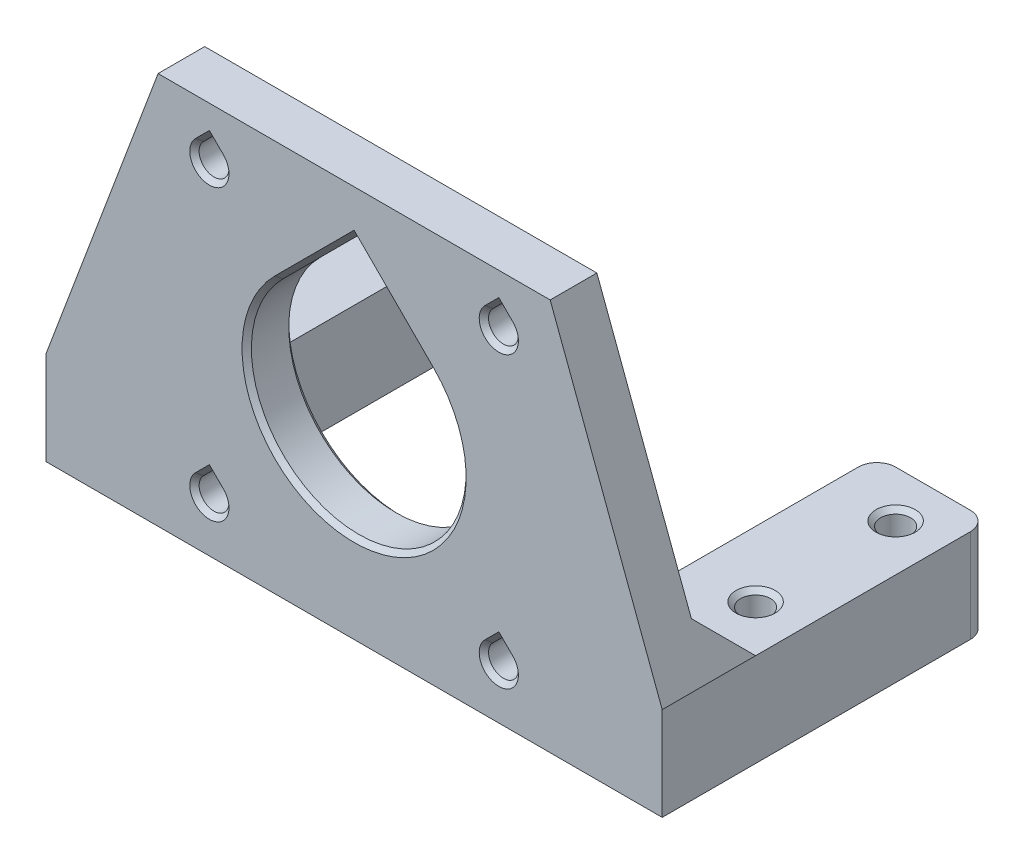
from build123d import *

# Parameters (mm, degrees)
EXTRUDE_1_DEPTH     = 5
SKETCH_2_W          = 12
SKETCH_2_H          = 10
EXTRUDE_2_DEPTH     = 30
EXTRUDE_3_DEPTH     = 5
SKETCH_5_R          = 1.6
CUT_EXTRUDE_1_DEPTH = 55.890800686
FILLET_1_R          = 2
CHAMFER_1_SIZE      = 5
CHAMFER_2_SIZE      = 0.5


with BuildPart() as part:
    # 草图1 → 凸台-拉伸1 (new body)
    with BuildSketch(Plane.XY):
        Polygon((-21, 21), (21, 21), (21, -11), (33, -11), (33, -21), (-33, -21), (-33, -11), (-21, -11), align=None)
        with BuildLine():
            Line((-15.5, 17.7627417), (-16.63137085, 16.63137085))
            ThreePointArc((-16.63137085, 16.63137085), (-15.5, 13.9), (-14.36862915, 16.63137085))
            Line((-14.36862915, 16.63137085), (-15.5, 17.7627417))
        make_face(mode=Mode.SUBTRACT)
        with BuildLine():
            Line((-15.5, -13.2372583), (-16.63137085, -14.36862915))
            ThreePointArc((-16.63137085, -14.36862915), (-15.5, -17.1), (-14.36862915, -14.36862915))
            Line((-14.36862915, -14.36862915), (-15.5, -13.2372583))
        make_face(mode=Mode.SUBTRACT)
        with BuildLine():
            Line((-8.131727984, 8.131727984), (0, 16.263455967))
            Line((0, 16.263455967), (8.131727984, 8.131727984))
            ThreePointArc((8.131727984, 8.131727984), (0, -11.5), (-8.131727984, 8.131727984))
        make_face(mode=Mode.SUBTRACT)
        with BuildLine():
            Line((15.5, -13.2372583), (14.36862915, -14.36862915))
            ThreePointArc((14.36862915, -14.36862915), (15.5, -17.1), (16.63137085, -14.36862915))
            Line((16.63137085, -14.36862915), (15.5, -13.2372583))
        make_face(mode=Mode.SUBTRACT)
        with BuildLine():
            Line((15.5, 17.7627417), (14.36862915, 16.63137085))
            ThreePointArc((14.36862915, 16.63137085), (15.5, 13.9), (16.63137085, 16.63137085))
            Line((16.63137085, 16.63137085), (15.5, 17.7627417))
        make_face(mode=Mode.SUBTRACT)
    extrude(amount=EXTRUDE_1_DEPTH)

    # 草图2 → 凸台-拉伸2 (add)
    with BuildSketch(Plane(origin=(0, 0, 0), x_dir=(-1, 0, 0), z_dir=(0, 0, -1))):
        with Locations((-27, -16)):
            Rectangle(SKETCH_2_W, SKETCH_2_H)
        with Locations((27, -16)):
            Rectangle(SKETCH_2_W, SKETCH_2_H)
    extrude(amount=EXTRUDE_2_DEPTH)

    # 草图3 → 凸台-拉伸3 (add)
    with BuildSketch(Plane.XY.offset(5)):
        Polygon((-21, 21), (-33, -11), (-21, -11), align=None)
        Polygon((21, -11), (21, 21), (33, -11), align=None)
    extrude(amount=-EXTRUDE_3_DEPTH)

    # 草图5 → 切除-拉伸1 (cut, through all)
    with BuildSketch(Plane(origin=(0, -11, 0), x_dir=(1, 0, 0), z_dir=(0, 1, 0))):
        with Locations(Location((28, 25, 0), (0, 0, 270))):
            Circle(SKETCH_5_R)
        with Locations(Location((28, 10, 0), (0, 0, 270))):
            Circle(SKETCH_5_R)
        with Locations(Location((-28, 10, 0), (0, 0, 270))):
            Circle(SKETCH_5_R)
        with Locations(Location((-28, 25, 0), (0, 0, 270))):
            Circle(SKETCH_5_R)
    extrude(amount=-CUT_EXTRUDE_1_DEPTH, mode=Mode.SUBTRACT)

    # 圆角1
    fillet_1_edges = [part.edges().sort_by_distance(p)[0] for p in [
        (33, -16, -30),
        (21, -16, -30),
        (-21, -16, -30),
        (-33, -16, -30),
    ]]
    fillet(fillet_1_edges, radius=FILLET_1_R)

    # 倒角1
    chamfer_1_edges = [part.edges().sort_by_distance(p)[0] for p in [
        (-27, -11, 0),
        (27, -11, 0),
    ]]
    chamfer(chamfer_1_edges, length=CHAMFER_1_SIZE)

    # 倒角2
    chamfer_2_edges = [part.edges().sort_by_distance(p)[0] for p in [
        (-28, -21, -26.6),
        (-28, -11, -26.6),
        (-28, -21, -11.6),
        (-28, -11, -11.6),
        (28, -21, -11.6),
        (28, -11, -11.6),
        (28, -21, -26.6),
        (28, -11, -26.6),
        (0, -11.5, 0),
        (4.065863992, 12.197591975, 0),
        (-4.065863992, 12.197591975, 0),
        (0, -11.5, 5),
        (4.065863992, 12.197591975, 5),
        (-4.065863992, 12.197591975, 5),
        (-15.5, -17.1, 0),
        (-14.934314575, -13.802943725, 0),
        (-16.065685425, -13.802943725, 0),
        (-15.5, -17.1, 5),
        (-14.934314575, -13.802943725, 5),
        (-16.065685425, -13.802943725, 5),
        (-15.5, 13.9, 0),
        (-14.934314575, 17.197056275, 0),
        (-16.065685425, 17.197056275, 0),
        (-15.5, 13.9, 5),
        (-14.934314575, 17.197056275, 5),
        (-16.065685425, 17.197056275, 5),
        (16.065685425, 17.197056275, 0),
        (14.934314575, 17.197056275, 0),
        (15.5, 13.9, 0),
        (16.065685425, 17.197056275, 5),
        (14.934314575, 17.197056275, 5),
        (15.5, 13.9, 5),
        (15.5, -17.1, 0),
        (16.065685425, -13.802943725, 0),
        (14.934314575, -13.802943725, 0),
        (15.5, -17.1, 5),
        (16.065685425, -13.802943725, 5),
        (14.934314575, -13.802943725, 5),
    ]]
    chamfer(chamfer_2_edges, length=CHAMFER_2_SIZE)


solid = part.part
